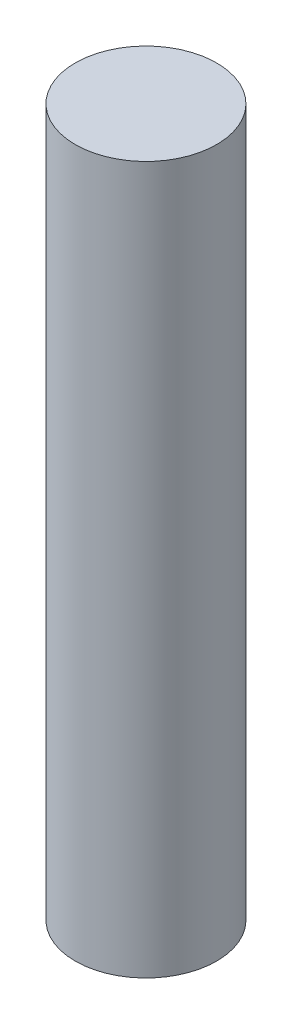
from build123d import *

# Parameters (mm, degrees)
SKETCH1_R           = 1.5
BOSS_EXTRUDE1_DEPTH = 15


with BuildPart() as part:
    # Sketch1 → Boss-Extrude1 (new body)
    with BuildSketch(Plane(origin=(0, 0, 0), x_dir=(1, 0, 0), z_dir=(0, 1, 0))):
        with Locations(Location((0, 0, 0), (0, 0, 270))):
            Circle(SKETCH1_R)
    extrude(amount=BOSS_EXTRUDE1_DEPTH)


solid = part.part
